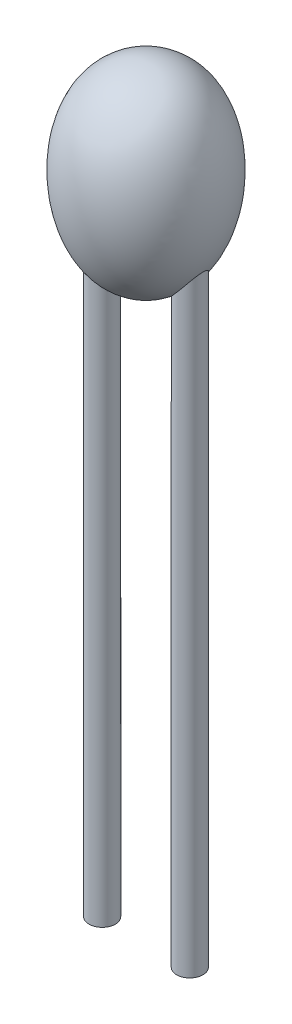
from build123d import *

# Parameters (mm, degrees)
BOSS_EXTRUDE1_DEPTH      = 6.6
BOSS_EXTRUDE1_DEPTH_BACK = 1
SKETCH2_R                = 0.15


with BuildPart() as part:
    # Sketch1 → Revolve1 (revolve)
    with BuildSketch(Plane.XY):
        with BuildLine():
            Line((0, 2.089637782), (0, 0))
            Line((0, 0), (0.371339903, 0))
            add(Edge.make_bspline(
                [(0, 2.089637782), (0.971685935, 2.076549426), (1.011515786, 0.452994607), (0.371339903, 0)],
                knots=[0, 0, 0, 0, 1, 1, 1, 1], degree=3))
        make_face()
    revolve(axis=Axis((0, 2.089637782, 0), (0, -1, 0)))

    # Sketch2 → Boss-Extrude1 (add, two sides: drawn at the far end of the back side and taken through both)
    with BuildSketch(Plane.XZ.offset(-BOSS_EXTRUDE1_DEPTH_BACK)):
        with Locations(Location((0.5, 0, 0), (0, 0, 270))):
            Circle(SKETCH2_R)
        with Locations(Location((-0.5, 0, 0), (0, 0, 333.815508665))):
            Circle(SKETCH2_R)
    extrude(amount=BOSS_EXTRUDE1_DEPTH + BOSS_EXTRUDE1_DEPTH_BACK)


solid = part.part
